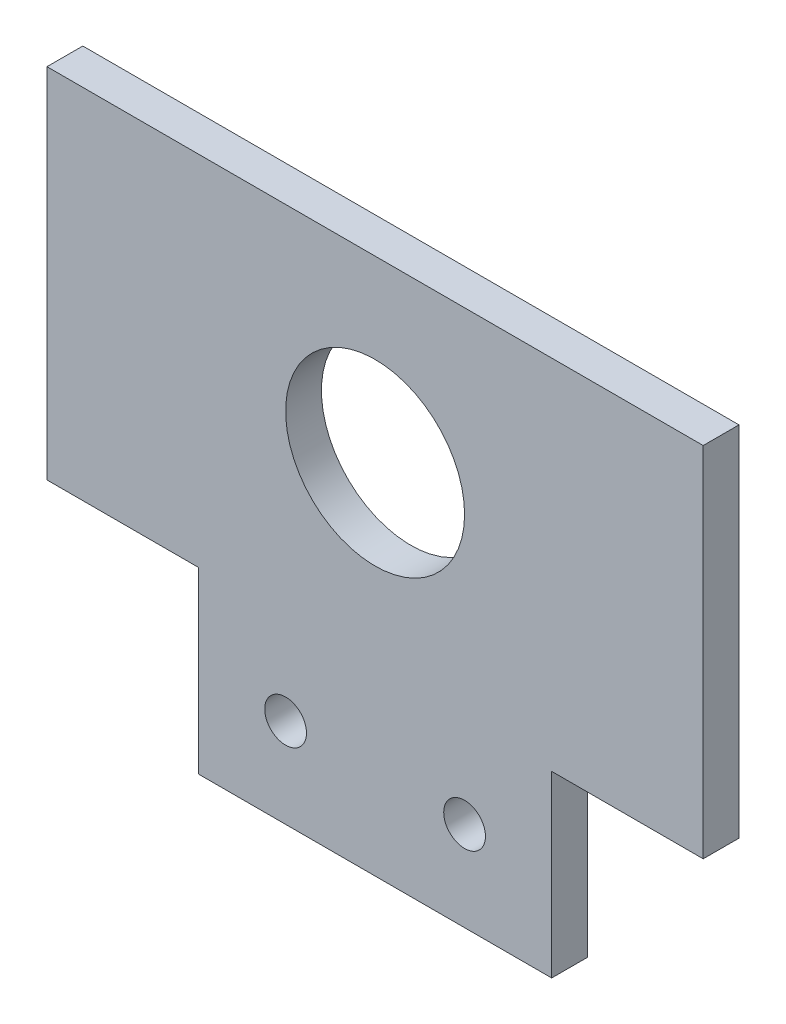
from build123d import *

# Parameters (mm, degrees)
SKETCH_1_R          = 7.5
EXTRUDE_1_DEPTH     = 3
SKETCH_2_R          = 1.75
CUT_EXTRUDE_1_DEPTH = 3


with BuildPart() as part:
    # 草图1 → 凸台-拉伸1 (new body)
    with BuildSketch(Plane.XY):
        Polygon((-14.8, -15), (14.8, -15), (14.8, 0), (27.5, 0), (27.5, 30), (-27.5, 30), (-27.5, 0), (-14.8, 0), align=None)
        with Locations((0, 15)):
            Circle(SKETCH_1_R, mode=Mode.SUBTRACT)
    extrude(amount=EXTRUDE_1_DEPTH)

    # 草图2 → 切除-拉伸1 (cut)
    with BuildSketch(Plane.XY.offset(3)):
        with Locations((-7.5, -7.5)):
            Circle(SKETCH_2_R)
        with Locations(Location((7.5, -7.5, 0), (0, 0, 180))):
            Circle(SKETCH_2_R)
    extrude(amount=-CUT_EXTRUDE_1_DEPTH, mode=Mode.SUBTRACT)


solid = part.part
